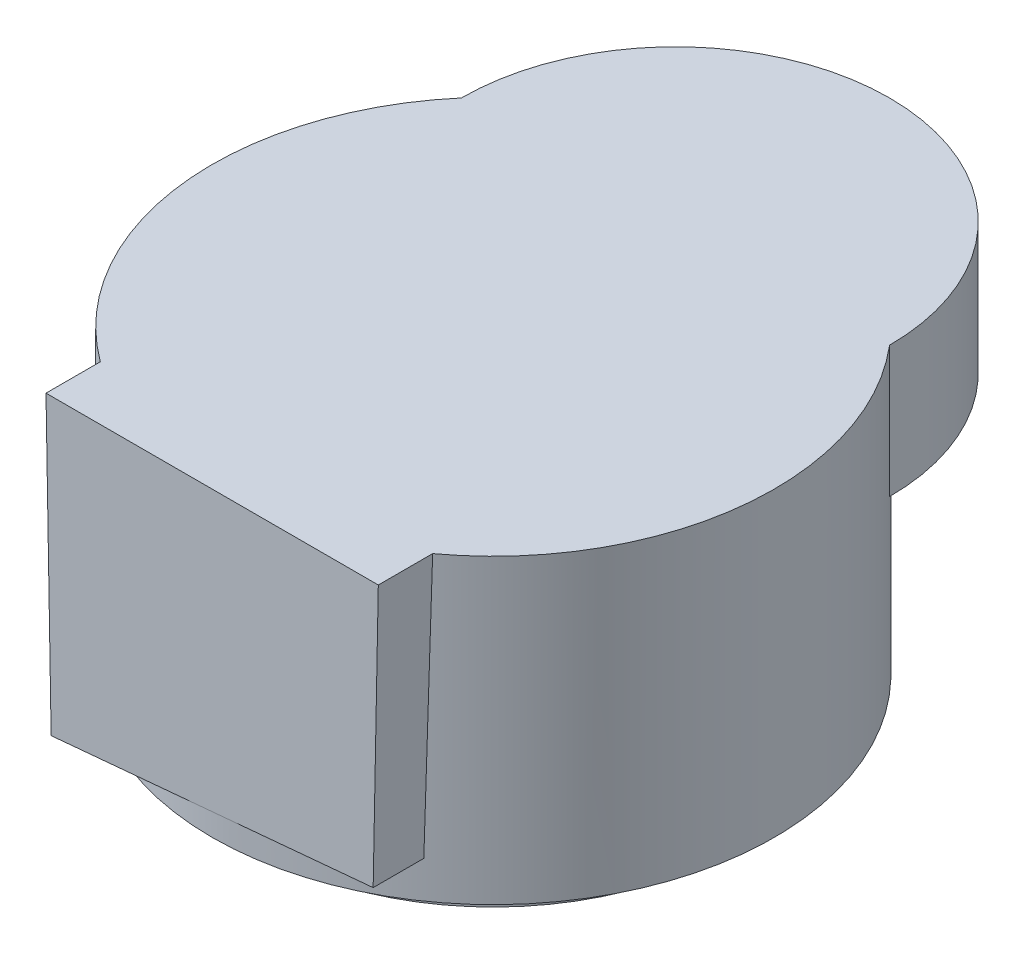
from build123d import *

# Parameters (mm, degrees)
CROQUIS1_R              = 8.035
SALIENTE_EXTRUIR1_DEPTH = 1.15
CROQUIS2_R              = 9.56
SALIENTE_EXTRUIR2_DEPTH = 10.26
SALIENTE_EXTRUIR3_START = -4.46
SALIENTE_EXTRUIR3_DEPTH = 4.46
SALIENTE_EXTRUIR4_DEPTH = 4.46


with BuildPart() as part:
    # Croquis1 → Saliente-Extruir1 (new body)
    with BuildSketch(Plane(origin=(0, 0, 0), x_dir=(1, 0, 0), z_dir=(0, 1, 0))):
        with Locations(Location((0, 0, 0), (0, 0, 270))):
            Circle(CROQUIS1_R)
    extrude(amount=SALIENTE_EXTRUIR1_DEPTH)

    # Croquis2 → Saliente-Extruir2 (add)
    with BuildSketch(Plane(origin=(0, 1.15, 0), x_dir=(1, 0, 0), z_dir=(0, 1, 0))):
        with Locations(Location((0, 0, 0), (0, 0, 270))):
            Circle(CROQUIS2_R)
    extrude(amount=SALIENTE_EXTRUIR2_DEPTH)

    # Croquis3 → Saliente-Extruir3 (add)
    with BuildSketch(Plane(origin=(0, 11.41, 0), x_dir=(1, 0, 0), z_dir=(0, 1, 0)).offset(SALIENTE_EXTRUIR3_START)):
        with BuildLine():
            ThreePointArc((-7.280024761, 6.196356953), (0, 13.476381713), (7.280024761, 6.196356953))
            ThreePointArc((7.280024761, 6.196356953), (0, -9.56), (-7.280024761, 6.196356953))
        make_face()
    extrude(amount=SALIENTE_EXTRUIR3_DEPTH)

    # Croquis6 → Saliente-Extruir4 (add)
    with BuildSketch(Plane.XY.offset(9.56)):
        Polygon((-5.475, 1.41), (5.475, 2.41), (5.65, 11.41), (-5.65, 11.41), align=None)
    extrude(amount=-SALIENTE_EXTRUIR4_DEPTH)


solid = part.part
